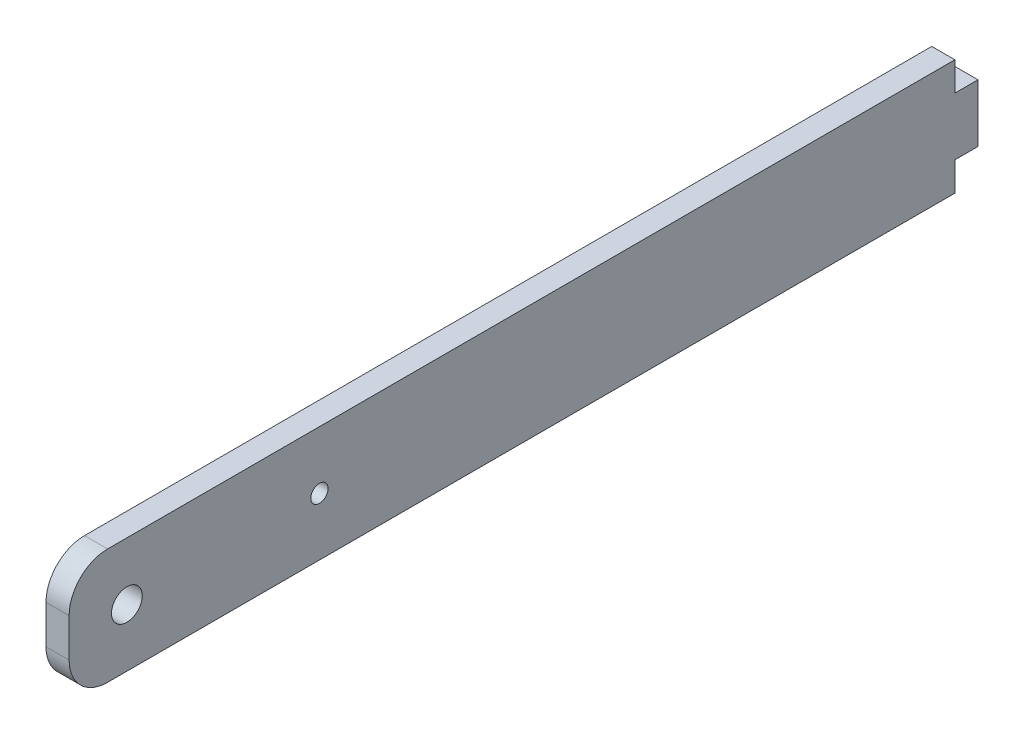
from build123d import *

# Parameters (mm, degrees)
CROQUIS2_W                   = 230
CROQUIS2_H                   = 30
CROQUIS2_R                   = 4
SALIENTE_EXTRUIR1_DEPTH      = 3
CROQUIS5_W                   = 6
CROQUIS5_H                   = 15
SALIENTE_EXTRUIR2_DEPTH      = 6
TALADRO_DE_MARGEN_PARA_M41_D = 4.5
REDONDEO1_R                  = 10


with BuildPart() as part:
    # Croquis2 → Saliente-Extruir1 (new, symmetric)
    with BuildSketch(Plane(origin=(0, 0, 0), x_dir=(0, 0, -1), z_dir=(1, 0, 0))):
        Rectangle(CROQUIS2_W, CROQUIS2_H)
        with Locations((-100, 0)):
            Circle(CROQUIS2_R, mode=Mode.SUBTRACT)
    extrude(amount=SALIENTE_EXTRUIR1_DEPTH, both=True)

    # Croquis5 → Saliente-Extruir2 (add, through all)
    with BuildSketch(Plane(origin=(3, 0, 0), x_dir=(0, 0, -1), z_dir=(1, 0, 0))):
        with Locations((118, 0)):
            Rectangle(CROQUIS5_W, CROQUIS5_H)
    extrude(amount=-SALIENTE_EXTRUIR2_DEPTH)

    # Taladro de margen para M41 (through all)
    with Locations(Plane(origin=(3, 0, 0), x_dir=(0, 0, -1), z_dir=(1, 0, 0))):
        with Locations((-50, 0)):
            Hole(TALADRO_DE_MARGEN_PARA_M41_D / 2)

    # Redondeo1
    redondeo1_edges = [part.edges().sort_by_distance(p)[0] for p in [
        (0, 15, 115),
        (0, -15, 115),
    ]]
    fillet(redondeo1_edges, radius=REDONDEO1_R)


solid = part.part
